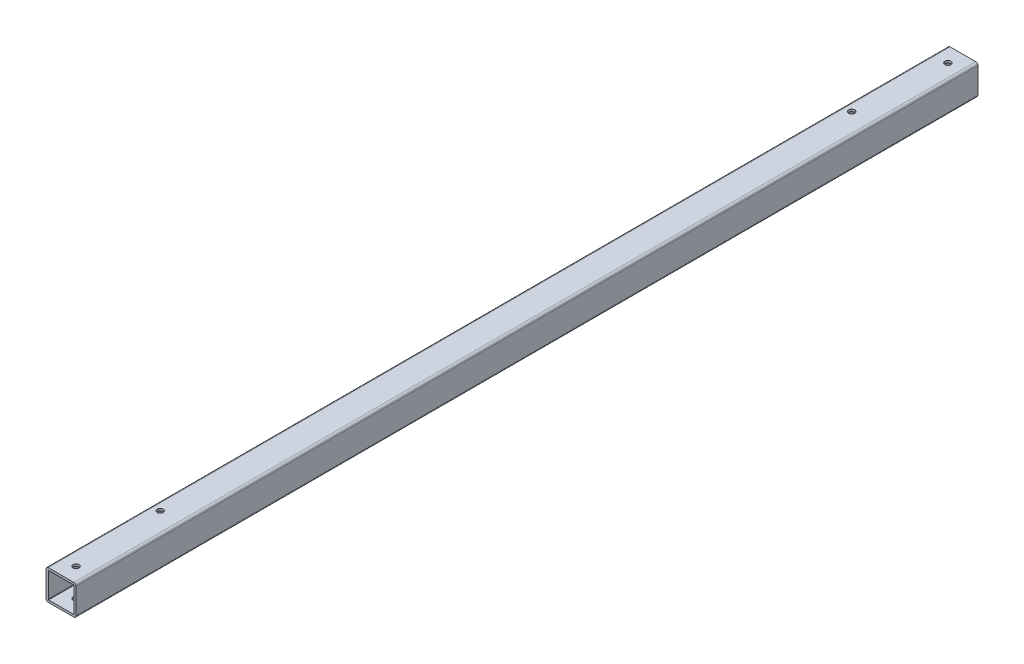
from build123d import *

# Parameters (mm, degrees)
SKETCH1_W                = 40
SKETCH1_H                = 40
SKETCH1_W_2              = 34
SKETCH1_H_2              = 34
EXTRUDE_THIN1_DEPTH      = 1200
FILLET1_R                = 0.5
FILLET2_R                = 3
F_8_0_8_DIAMETER_HOLE1_D = 8
F_8_0_8_DIAMETER_HOLE2_D = 8


with BuildPart() as part:
    # Sketch1 → Extrude-Thin1 (new body)
    with BuildSketch(Plane.XY):
        Rectangle(SKETCH1_W, SKETCH1_H)
        Rectangle(SKETCH1_W_2, SKETCH1_H_2, mode=Mode.SUBTRACT)
    extrude(amount=EXTRUDE_THIN1_DEPTH)

    # Fillet1
    fillet1_edges = [part.edges().sort_by_distance(p)[0] for p in [
        (17, -17, 600),
        (17, 17, 600),
        (-17, 17, 600),
        (-17, -17, 600),
    ]]
    fillet(fillet1_edges, radius=FILLET1_R)

    # Fillet2
    fillet2_edges = [part.edges().sort_by_distance(p)[0] for p in [
        (20, -20, 600),
        (-20, -20, 600),
        (-20, 20, 600),
        (20, 20, 600),
    ]]
    fillet(fillet2_edges, radius=FILLET2_R)

    # Ø8.0 (8) Diameter Hole1 (through all)
    with Locations(Plane(origin=(0, 20, 0), x_dir=(1, 0, 0), z_dir=(0, 1, 0))):
        with Locations((0, -20), (0, -1180)):
            Hole(F_8_0_8_DIAMETER_HOLE1_D / 2)

    # Ø8.0 (8) Diameter Hole2 (through all)
    with Locations(Plane(origin=(0, 20, 0), x_dir=(1, 0, 0), z_dir=(0, 1, 0))):
        with Locations((-8, -1060), (-8, -140)):
            Hole(F_8_0_8_DIAMETER_HOLE2_D / 2)


solid = part.part
